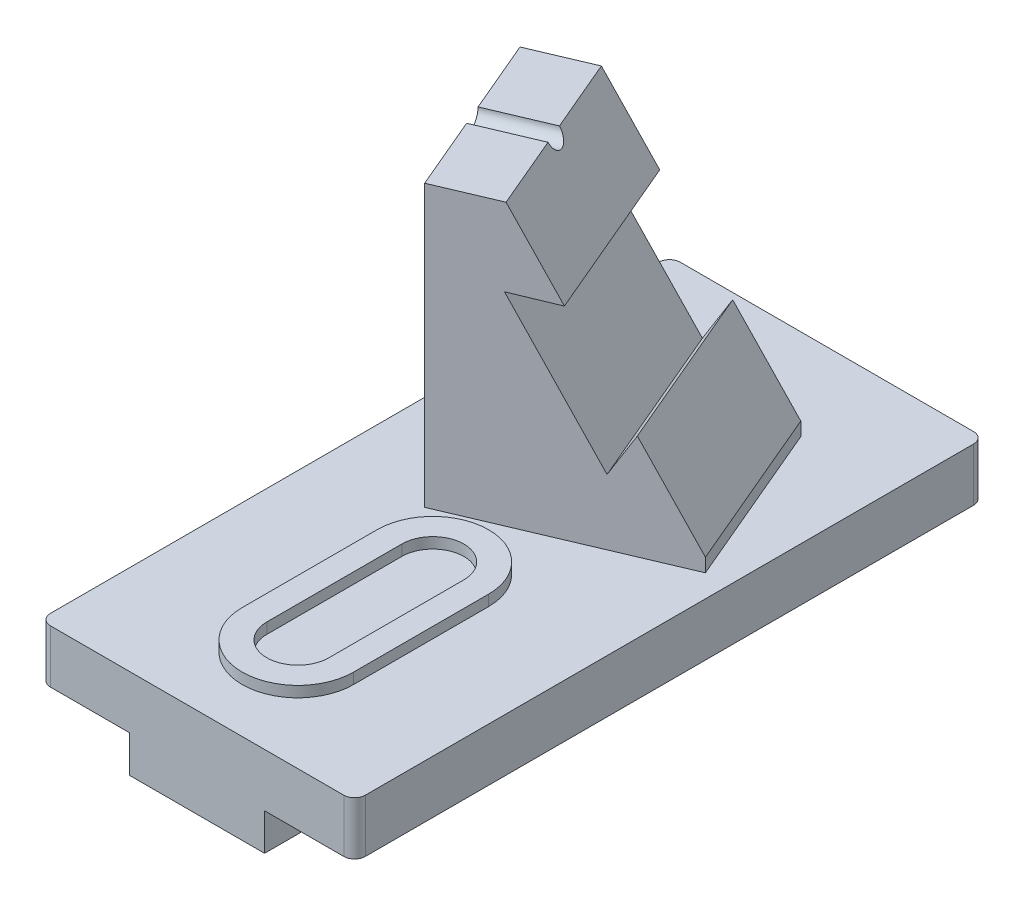
from build123d import *

# Parameters (mm, degrees)
BOSS_EXTRUDE1_DEPTH     = 700
FILLET1_R               = 12
BOSS_EXTRUDE2_DEPTH     = 12
BOSS_EXTRUDE3_DEPTH     = 200
CUT_EXTRUDE1_DEPTH      = 785.28509614
CUT_EXTRUDE1_DEPTH_BACK = 785.28509614


with BuildPart() as part:
    # Sketch1 → Boss-Extrude1 (new body)
    with BuildSketch(Plane.XY):
        Polygon((-175, 0), (175, 0), (175, -59), (75, -59), (75, -100), (-75, -100), (-75, -59), (-175, -59), align=None)
    extrude(amount=BOSS_EXTRUDE1_DEPTH)

    # Fillet1
    fillet1_edges = [part.edges().sort_by_distance(p)[0] for p in [
        (-175, -29.5, 0),
        (175, -29.5, 700),
        (-175, -29.5, 700),
        (175, -29.5, 0),
    ]]
    fillet(fillet1_edges, radius=FILLET1_R)

    # Sketch2 → Boss-Extrude2 (add)
    with BuildSketch(Plane(origin=(0, 0, 0), x_dir=(1, 0, 0), z_dir=(0, 1, 0))):
        with BuildLine():
            Line((-62, -588), (-62, -438))
            ThreePointArc((-62, -438), (0, -376), (62, -438))
            Line((62, -438), (62, -588))
            ThreePointArc((62, -588), (0, -650), (-62, -588))
        make_face()
        with BuildLine():
            Line((-34.5, -588), (-34.5, -438))
            ThreePointArc((-34.5, -438), (0, -403.5), (34.5, -438))
            Line((34.5, -438), (34.5, -588))
            ThreePointArc((34.5, -588), (0, -622.5), (-34.5, -588))
        make_face(mode=Mode.SUBTRACT)
    extrude(amount=BOSS_EXTRUDE2_DEPTH)

    # Sketch4 → Boss-Extrude3 (add)
    with BuildSketch(Plane(origin=(125.406543764, 0, 295.439302816), x_dir=(-0.9205048534524398, 0, 0.39073112848927494), z_dir=(-0.39073112848927494, 0, -0.9205048534524398))):
        Polygon((-26.717356398, 0), (211.282643602, 0), (211.282643602, 312), (142.282643602, 312), (92.826407103, 225.085785562), (143.632232896, 225.404217347), (56.684794392, 72.60309761), (31.00611148, 116.443017514), (-26.717356398, 15), align=None)
    extrude(amount=BOSS_EXTRUDE3_DEPTH)

    # Sketch5 → Cut-Extrude1 (cut, two sides: drawn at the far end of the back side and taken through both)
    with BuildSketch(Plane(origin=(-194.486698886, 0, 82.554705765), x_dir=(0.39073112848927494, 0, 0.9205048534524398), z_dir=(-0.9205048534524398, 0, 0.39073112848927494)).offset(-CUT_EXTRUDE1_DEPTH_BACK)):
        with BuildLine():
            Line((208.953552507, 1623.592968805), (208.953552507, 312))
            ThreePointArc((208.953552507, 312), (220.953552507, 300), (232.953552507, 312))
            Line((232.953552507, 312), (232.953552507, 1623.592968805))
            Line((232.953552507, 1623.592968805), (232.953552507, 4246.778906414))
            Line((232.953552507, 4246.778906414), (208.953552507, 4246.778906414))
            Line((208.953552507, 4246.778906414), (208.953552507, 1623.592968805))
        make_face()
    extrude(amount=CUT_EXTRUDE1_DEPTH + CUT_EXTRUDE1_DEPTH_BACK, mode=Mode.SUBTRACT)


solid = part.part
